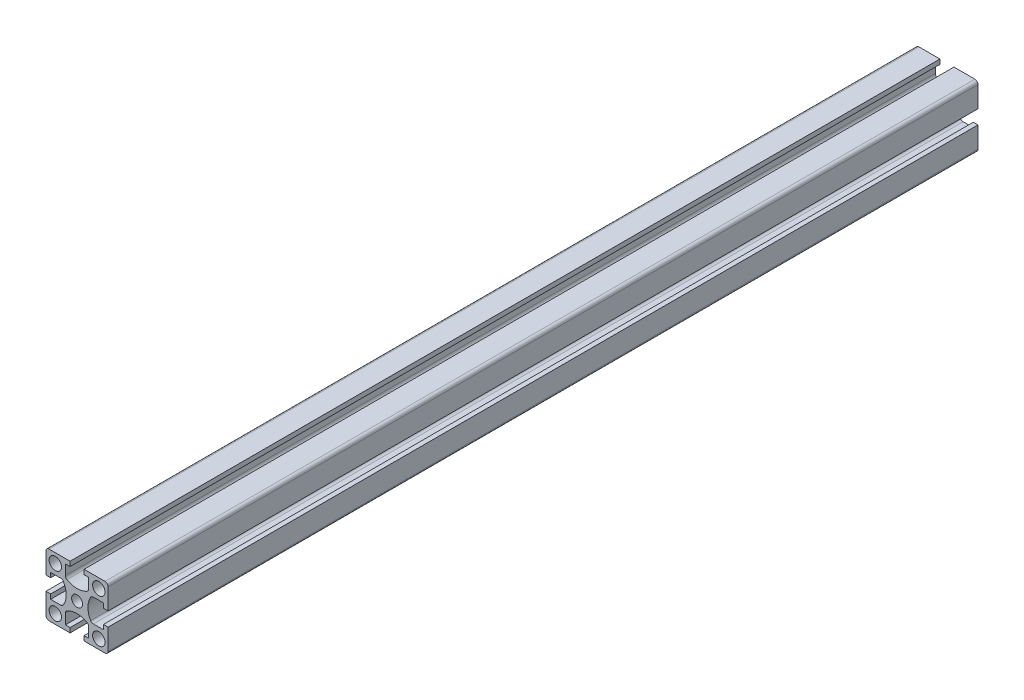
from build123d import *

# Parameters (mm, degrees)
SKETCH1_R           = 5
SKETCH1_R_2         = 4.375
BOSS_EXTRUDE1_DEPTH = 700


with BuildPart() as part:
    # Sketch1 → Boss-Extrude1 (new body)
    with BuildSketch(Plane.XY):
        with BuildLine():
            Line((-25, 22.5), (-25, 5.625))
            Line((-25, 5.625), (-21.25, 5.625))
            Line((-21.25, 5.625), (-21.25, 9.375))
            Line((-21.25, 9.375), (-13.092150698, 9.375))
            ThreePointArc((-13.092150698, 9.375), (-11.842150698, 9.040063509), (-10.927087189, 8.125))
            ThreePointArc((-10.927087189, 8.125), (-8.75, 0), (-10.927087189, -8.125))
            ThreePointArc((-10.927087189, -8.125), (-11.842150698, -9.040063509), (-13.092150698, -9.375))
            Line((-13.092150698, -9.375), (-21.25, -9.375))
            Line((-21.25, -9.375), (-21.25, -5.625))
            Line((-21.25, -5.625), (-25, -5.625))
            Line((-25, -5.625), (-25, -22.5))
            ThreePointArc((-25, -22.5), (-24.267766953, -24.267766953), (-22.5, -25))
            Line((-22.5, -25), (-5.625, -25))
            Line((-5.625, -25), (-5.625, -21.25))
            Line((-5.625, -21.25), (-9.375, -21.25))
            Line((-9.375, -21.25), (-9.375, -13.092150698))
            ThreePointArc((-9.375, -13.092150698), (-9.040063509, -11.842150698), (-8.125, -10.927087189))
            ThreePointArc((-8.125, -10.927087189), (0, -8.75), (8.125, -10.927087189))
            ThreePointArc((8.125, -10.927087189), (9.040063509, -11.842150698), (9.375, -13.092150698))
            Line((9.375, -13.092150698), (9.375, -21.25))
            Line((9.375, -21.25), (5.625, -21.25))
            Line((5.625, -21.25), (5.625, -25))
            Line((5.625, -25), (22.5, -25))
            ThreePointArc((22.5, -25), (24.267766953, -24.267766953), (25, -22.5))
            Line((25, -22.5), (25, -5.625))
            Line((25, -5.625), (21.25, -5.625))
            Line((21.25, -5.625), (21.25, -9.375))
            Line((21.25, -9.375), (13.092150698, -9.375))
            ThreePointArc((13.092150698, -9.375), (11.842150698, -9.040063509), (10.927087189, -8.125))
            ThreePointArc((10.927087189, -8.125), (8.75, 0), (10.927087189, 8.125))
            ThreePointArc((10.927087189, 8.125), (11.842150698, 9.040063509), (13.092150698, 9.375))
            Line((13.092150698, 9.375), (21.25, 9.375))
            Line((21.25, 9.375), (21.25, 5.625))
            Line((21.25, 5.625), (25, 5.625))
            Line((25, 5.625), (25, 22.5))
            ThreePointArc((25, 22.5), (24.267766953, 24.267766953), (22.5, 25))
            Line((22.5, 25), (5.625, 25))
            Line((5.625, 25), (5.625, 21.25))
            Line((5.625, 21.25), (9.375, 21.25))
            Line((9.375, 21.25), (9.375, 13.092150698))
            ThreePointArc((9.375, 13.092150698), (9.040063509, 11.842150698), (8.125, 10.927087189))
            ThreePointArc((8.125, 10.927087189), (0, 8.75), (-8.125, 10.927087189))
            ThreePointArc((-8.125, 10.927087189), (-9.040063509, 11.842150698), (-9.375, 13.092150698))
            Line((-9.375, 13.092150698), (-9.375, 21.25))
            Line((-9.375, 21.25), (-5.625, 21.25))
            Line((-5.625, 21.25), (-5.625, 25))
            Line((-5.625, 25), (-22.5, 25))
            ThreePointArc((-22.5, 25), (-24.267766953, 24.267766953), (-25, 22.5))
        make_face()
        with Locations((-17.5, -17.5)):
            Circle(SKETCH1_R, mode=Mode.SUBTRACT)
        with Locations((17.5, -17.5)):
            Circle(SKETCH1_R, mode=Mode.SUBTRACT)
        with Locations((17.5, 17.5)):
            Circle(SKETCH1_R, mode=Mode.SUBTRACT)
        Circle(SKETCH1_R_2, mode=Mode.SUBTRACT)
        with Locations((-17.5, 17.5)):
            Circle(SKETCH1_R, mode=Mode.SUBTRACT)
    extrude(amount=BOSS_EXTRUDE1_DEPTH)


solid = part.part
